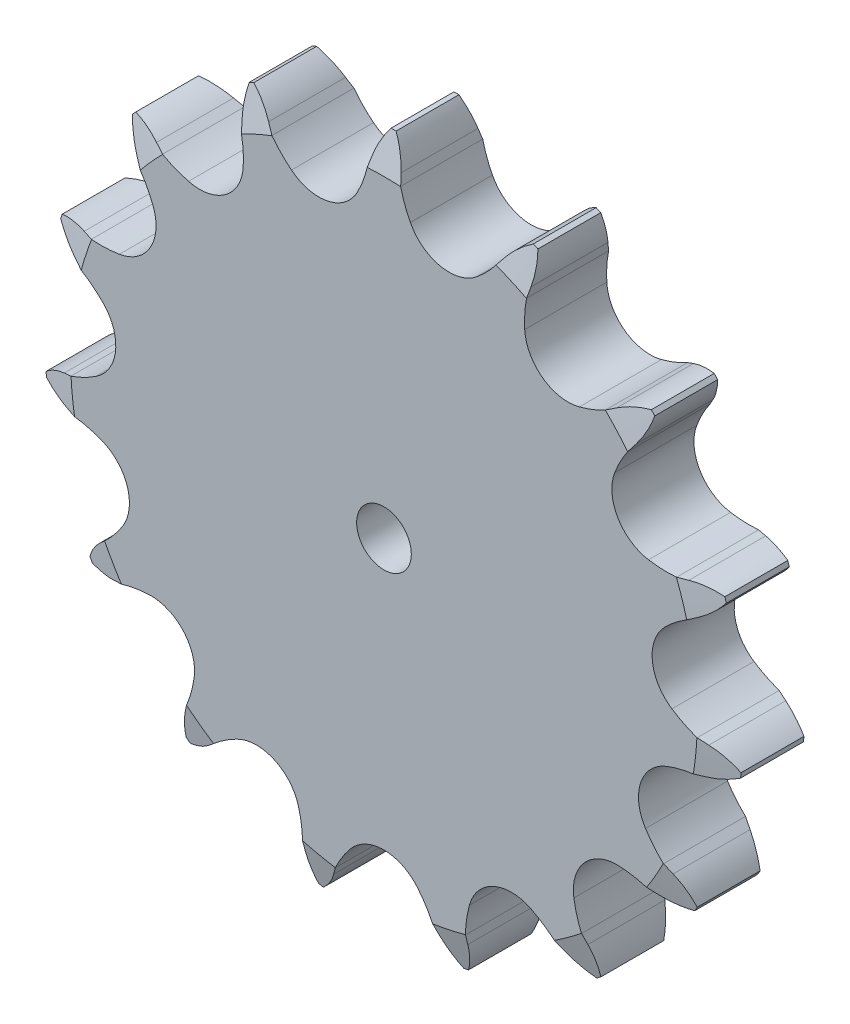
from build123d import *

# Parameters (mm, degrees)
SKETCH3_W           = 6
SKETCH3_H           = 21.527
CUT_EXTRUDE4_DEPTH  = 37.225066708
CIRPATTERN2_COUNT   = 15
SKETCH5_OUTSIDE_W   = 347.184
SKETCH5_OUTSIDE_H   = 346.906
SKETCH5_OUTSIDE_R   = 22.906359817
CUT_EXTRUDE5_DEPTH  = 37.511357447
CUT_EXTRUDE5_DRAFT  = -75
SKETCH6_OUTSIDE_W   = 347.184
SKETCH6_OUTSIDE_H   = 346.906
SKETCH6_OUTSIDE_R   = 22.906359817
CUT_EXTRUDE6_DEPTH  = 37.511357603
CUT_EXTRUDE6_DRAFT  = -75
BOSS_EXTRUDE1_START = -6
SKETCH8_R           = 4
SKETCH8_R_2         = 2
BOSS_EXTRUDE1_DEPTH = 6


with BuildPart() as part:
    # Sketch3 → Revolve5 (revolve)
    with BuildSketch(Plane(origin=(0, 0, 0), x_dir=(0, 0, -1), z_dir=(1, 0, 0)), mode=Mode.PRIVATE) as revolve5_sk:
        with Locations((0, 14.7635)):
            Rectangle(SKETCH3_W, SKETCH3_H)
    revolve(revolve5_sk.sketch.rotate(Axis((0, 0, 3), (0, 0, -1)), 180), axis=Axis((0, 0, 3), (0, 0, -1)))

    # Sketch4 → Cut-Extrude4 (cut, symmetric)
    with BuildSketch(Plane.XY):
        with BuildLine():
            Line((1.219884983, 22.88872777), (1.063923116, 23.578912677))
            ThreePointArc((1.063923116, 23.578912677), (0.65856297, 24.734033373), (0, 25.765980797))
            ThreePointArc((0, 25.765980797), (5.974327611, 28.107001564), (10.479968535, 23.538394719))
            ThreePointArc((10.479968535, 23.538394719), (9.458610494, 22.863525529), (8.61846566, 21.973145089))
            Line((8.61846566, 21.973145089), (8.195263912, 21.406065208))
            ThreePointArc((8.195263912, 21.406065208), (7.524676999, 20.626400483), (6.762535268, 19.935963031))
            ThreePointArc((6.762535268, 19.935963031), (4.101738454, 19.297162233), (1.930803303, 20.962979364))
            ThreePointArc((1.930803303, 20.962979364), (1.515378398, 21.903716331), (1.219884983, 22.88872777))
        make_face()
    cut_extrude4 = extrude(amount=CUT_EXTRUDE4_DEPTH, both=True, mode=Mode.SUBTRACT)

    # CirPattern2: Cut-Extrude4 ×15 about axis
    cirpattern2_axis = Axis((0, 0, 0), (0, 0, 1))
    for i in range(1, CIRPATTERN2_COUNT):
        add(cut_extrude4.rotate(cirpattern2_axis, i * 360 / CIRPATTERN2_COUNT), mode=Mode.SUBTRACT)


with BuildPart() as cut_extrude5_tool:
    # Sketch5 outside → Cut-Extrude5 (with draft: the straight prism first)
    with BuildSketch(Plane.XY.offset(3)):
        with Locations((0, 0.26)):
            Rectangle(SKETCH5_OUTSIDE_W, SKETCH5_OUTSIDE_H)
        Circle(SKETCH5_OUTSIDE_R, mode=Mode.SUBTRACT)
    extrude(amount=-CUT_EXTRUDE5_DEPTH)
    # Cut-Extrude5: the draft: its side faces are tilted about the plane it starts from
    cut_extrude5_sides = [cut_extrude5_tool.faces().sort_by_distance(p)[0] for p in [
        (0, -173.193, -15.755678724),
        (173.592, 0.26, -15.755678724),
        (0, 173.713, -15.755678724),
        (-173.592, 0.26, -15.755678724),
        (-22.906359817, 0, -15.755678724),
    ]]
    draft(cut_extrude5_sides, Plane.XY.offset(3), CUT_EXTRUDE5_DRAFT)


with BuildPart() as part_1:
    add(part.part)

    # Cut-Extrude5: cut by cut_extrude5_tool
    add(cut_extrude5_tool.part, mode=Mode.SUBTRACT)


with BuildPart() as cut_extrude6_tool:
    # Sketch6 outside → Cut-Extrude6 (with draft: the straight prism first)
    with BuildSketch(Plane(origin=(0, 0, -3), x_dir=(-1, 0, 0), z_dir=(0, 0, -1))):
        with Locations((0, 0.26)):
            Rectangle(SKETCH6_OUTSIDE_W, SKETCH6_OUTSIDE_H)
        Circle(SKETCH6_OUTSIDE_R, mode=Mode.SUBTRACT)
    extrude(amount=-CUT_EXTRUDE6_DEPTH)
    # Cut-Extrude6: the draft: its side faces are tilted about the plane it starts from
    cut_extrude6_sides = [cut_extrude6_tool.faces().sort_by_distance(p)[0] for p in [
        (0, -173.193, 15.755678802),
        (-173.592, 0.26, 15.755678802),
        (0, 173.713, 15.755678802),
        (173.592, 0.26, 15.755678802),
        (22.906359817, 0, 15.755678802),
    ]]
    draft(cut_extrude6_sides, Plane(origin=(0, 0, -3), x_dir=(-1, 0, 0), z_dir=(0, 0, -1)), CUT_EXTRUDE6_DRAFT)


with BuildPart() as part_2:
    add(part_1.part)

    # Cut-Extrude6: cut by cut_extrude6_tool
    add(cut_extrude6_tool.part, mode=Mode.SUBTRACT)

    # Sketch8 → Boss-Extrude1 (add)
    with BuildSketch(Plane.XY.offset(3).offset(BOSS_EXTRUDE1_START)):
        Circle(SKETCH8_R)
        Circle(SKETCH8_R_2, mode=Mode.SUBTRACT)
    extrude(amount=BOSS_EXTRUDE1_DEPTH)


solid = part_2.part
